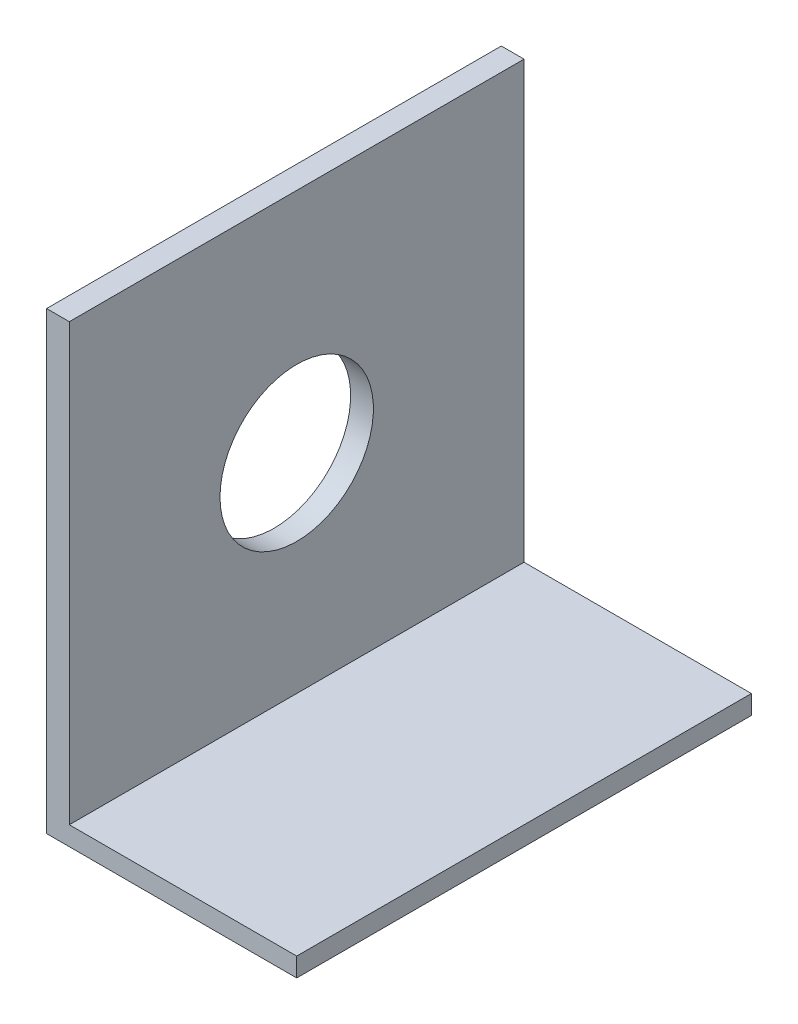
from build123d import *

# Parameters (mm, degrees)
BOSS_EXTRUDE1_DEPTH = 40
SKETCH2_R           = 6.746805348
CUT_EXTRUDE1_DEPTH  = 40


with BuildPart() as part:
    # Sketch1 → Boss-Extrude1 (new body)
    with BuildSketch(Plane.XY):
        Polygon((-28.677527702, 27.108013937), (-28.677527702, -12.891986063), (-6.677527702, -12.891986063), (-6.677527702, -11.219512195), (-26.677527702, -11.219512195), (-26.677527702, 27.108013937), (-27.701917946, 27.108013937), align=None)
    extrude(amount=BOSS_EXTRUDE1_DEPTH)

    # Sketch2 → Cut-Extrude1 (cut)
    with BuildSketch(Plane.ZY.offset(28.677527702)):
        with Locations((20, 7.108013937)):
            Circle(SKETCH2_R)
    extrude(amount=-CUT_EXTRUDE1_DEPTH, mode=Mode.SUBTRACT)


solid = part.part
